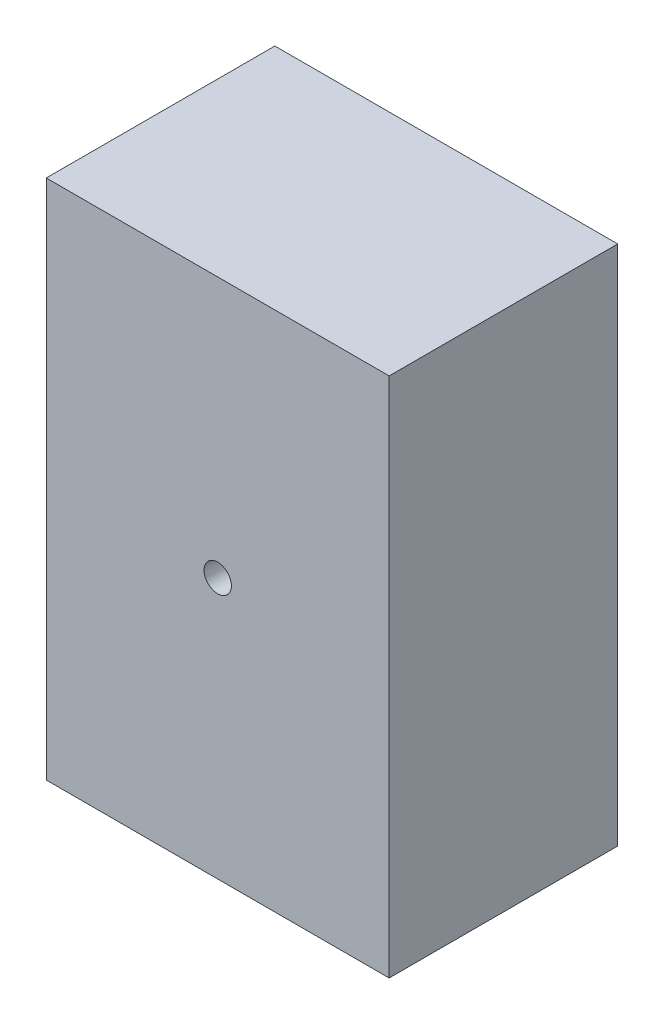
from build123d import *

# Parameters (mm, degrees)
SKETCH2_W           = 38.1
SKETCH2_H           = 57.94375
BOSS_EXTRUDE1_DEPTH = 25.4
SKETCH3_R           = 1.52
CUT_EXTRUDE1_DEPTH  = 43.981764052


with BuildPart() as part:
    # Sketch2 → Boss-Extrude1 (new body)
    with BuildSketch(Plane.XY):
        Rectangle(SKETCH2_W, SKETCH2_H)
    extrude(amount=BOSS_EXTRUDE1_DEPTH)

    # Sketch3 → Cut-Extrude1 (cut, through all)
    with BuildSketch(Plane.XY.offset(25.4)):
        Circle(SKETCH3_R)
    extrude(amount=-CUT_EXTRUDE1_DEPTH, mode=Mode.SUBTRACT)


solid = part.part
